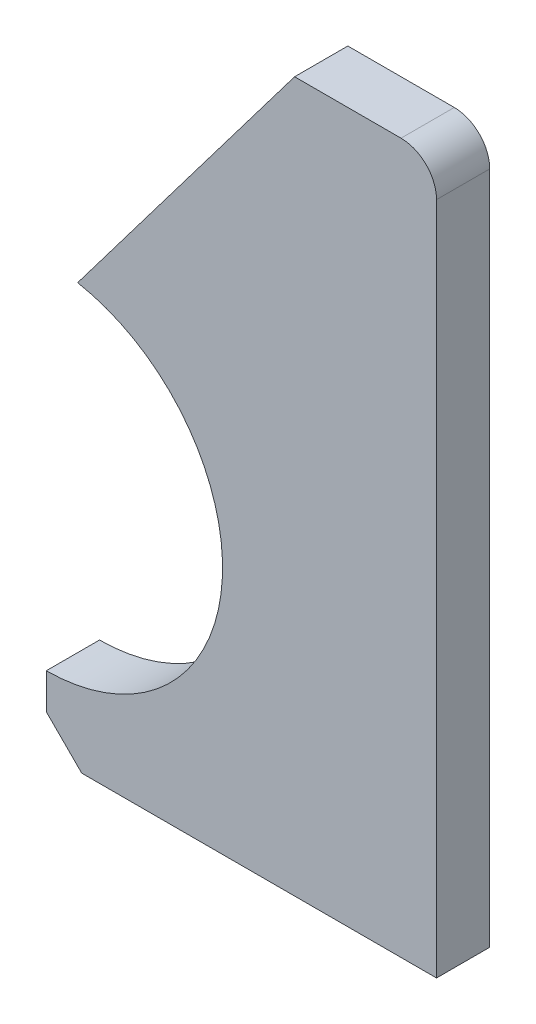
from build123d import *

# Parameters (mm, degrees)
BOSS_EXTRUDE1_DEPTH = 15


with BuildPart() as part:
    # Sketch1 → Boss-Extrude1 (new body)
    with BuildSketch(Plane.XY):
        with BuildLine():
            Line((0, 0), (100, 0))
            Line((100, 0), (100, 190))
            ThreePointArc((100, 190), (97.071067812, 197.071067812), (90, 200))
            Line((90, 200), (60, 200))
            Line((60, 200), (-1.149354388, 119.153849333))
            ThreePointArc((-1.149354388, 119.153849333), (39.497953664, 65.553662986), (-10, 20))
            Line((-10, 20), (-10, 10))
            Line((-10, 10), (0, 0))
        make_face()
    extrude(amount=BOSS_EXTRUDE1_DEPTH)


solid = part.part
